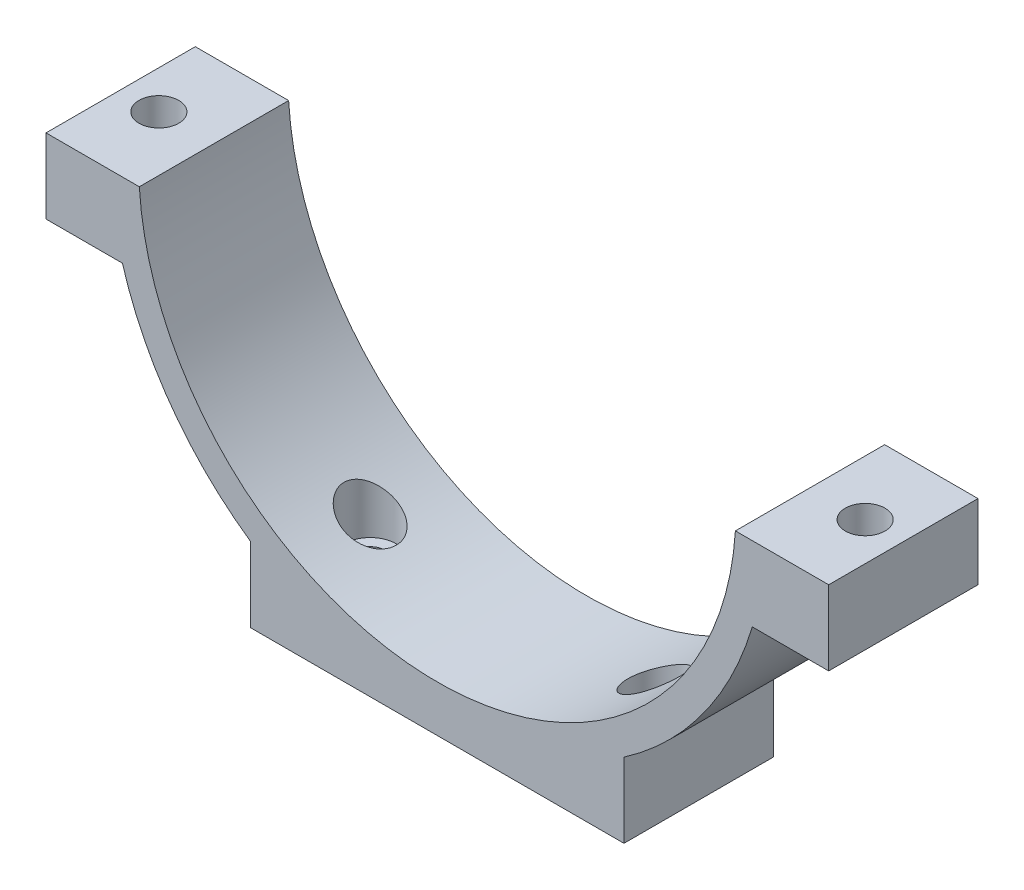
from build123d import *

# Parameters (mm, degrees)
BOSS_EXTRUDE1_DEPTH               = 12.7
F_1_4_CLEARANCE_HOLE1_D           = 6.7564
F_1_4_CLEARANCE_HOLE1_CSINK_D     = 8.0264
F_1_4_CLEARANCE_HOLE1_CSINK_ANGLE = 90
BOSS_EXTRUDE2_START               = -25.4
BOSS_EXTRUDE2_DEPTH               = 25.4
F_10_CLEARANCE_HOLE1_D            = 5.1054
F_10_CLEARANCE_HOLE1_CSINK_D      = 6.3754
F_10_CLEARANCE_HOLE1_CSINK_ANGLE  = 90
CUT_EXTRUDE1_START                = -7.62
SKETCH13_R                        = 4.445
CUT_EXTRUDE1_DEPTH                = 25.4


with BuildPart() as part:
    # Sketch1 → Boss-Extrude1 (new, symmetric)
    with BuildSketch(Plane.XY):
        with BuildLine():
            Line((-50.700684167, 47.625), (-66.575684167, 47.625))
            Line((-66.575684167, 47.625), (-66.575684167, 34.925))
            Line((-66.575684167, 34.925), (-53.577595831, 34.925))
            ThreePointArc((-53.577595831, 34.925), (0, -5.08), (53.577595831, 34.925))
            Line((53.577595831, 34.925), (66.575684167, 34.925))
            Line((66.575684167, 34.925), (66.575684167, 47.625))
            Line((66.575684167, 47.625), (50.700684167, 47.625))
            ThreePointArc((50.700684167, 47.625), (0, 0), (-50.700684167, 47.625))
        make_face()
    extrude(amount=BOSS_EXTRUDE1_DEPTH, both=True)

    # 1/4 Clearance Hole1 (through all)
    with Locations(Plane(origin=(0, 34.925, 0), x_dir=(-1, 0, 0), z_dir=(0, -1, 0))):
        with Locations((60.076639999, 0), (-60.076639999, 0)):
            CounterSinkHole(F_1_4_CLEARANCE_HOLE1_D / 2, F_1_4_CLEARANCE_HOLE1_CSINK_D / 2, counter_sink_angle=F_1_4_CLEARANCE_HOLE1_CSINK_ANGLE)

    # Sketch5 → Boss-Extrude2 (add)
    with BuildSketch(Plane(origin=(0, 0, -12.7), x_dir=(-1, 0, 0), z_dir=(0, 0, -1)).offset(BOSS_EXTRUDE2_START)):
        with BuildLine():
            Line((-31.75, -7.883822155), (31.75, -7.883822155))
            Line((31.75, -7.883822155), (31.75, 4.816177845))
            ThreePointArc((31.75, 4.816177845), (0, -5.08), (-31.75, 4.816177845))
            Line((-31.75, 4.816177845), (-31.75, -7.883822155))
        make_face()
    extrude(amount=BOSS_EXTRUDE2_DEPTH)

    # #10 Clearance Hole1 (through all)
    with Locations(Plane(origin=(0, -7.883822155, 0), x_dir=(-1, 0, 0), z_dir=(0, -1, 0))):
        with Locations((24.13, 0), (-24.13, 0)):
            CounterSinkHole(F_10_CLEARANCE_HOLE1_D / 2, F_10_CLEARANCE_HOLE1_CSINK_D / 2, counter_sink_angle=F_10_CLEARANCE_HOLE1_CSINK_ANGLE)

    # Sketch13 → Cut-Extrude1 (cut)
    with BuildSketch(Plane.XZ.offset(7.883822155).offset(CUT_EXTRUDE1_START)):
        with Locations(Location((-24.13, 0, 0), (0, 0, 270))):
            Circle(SKETCH13_R)
        with Locations(Location((24.13, 0, 0), (0, 0, 270))):
            Circle(SKETCH13_R)
    extrude(amount=-CUT_EXTRUDE1_DEPTH, mode=Mode.SUBTRACT)


solid = part.part
